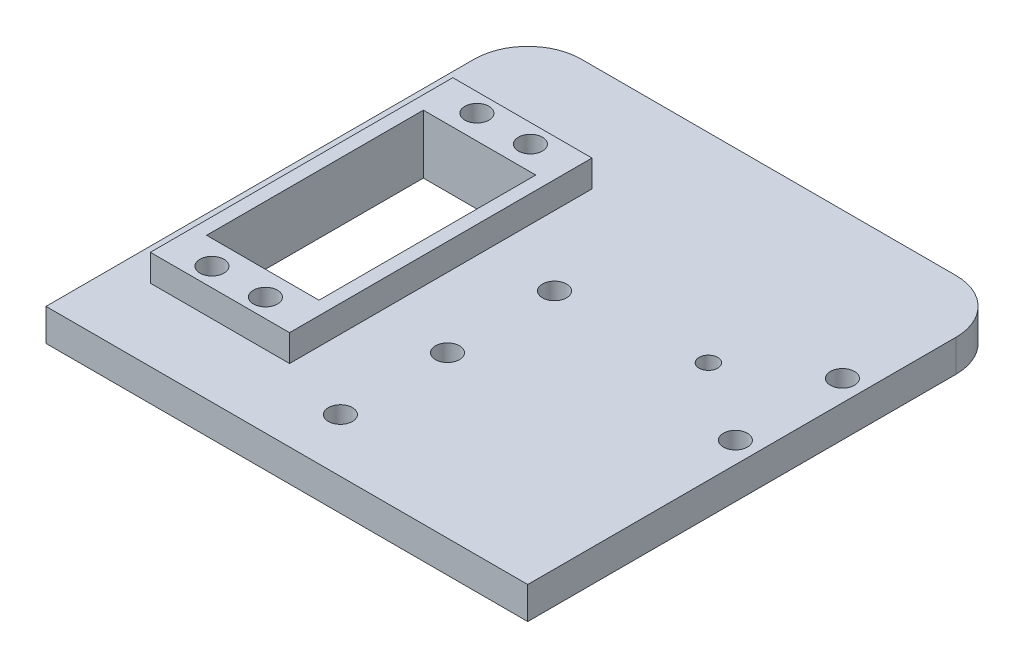
from build123d import *

# Parameters (mm, degrees)
SKETCH1_W           = 90
SKETCH1_H           = 90
BOSS_EXTRUDE1_DEPTH = 6
SKETCH2_W           = 26
SKETCH2_H           = 56.5
BOSS_EXTRUDE2_DEPTH = 5
SKETCH3_W           = 21
SKETCH3_H           = 40.5
CUT_EXTRUDE1_DEPTH  = 12
SKETCH4_R           = 2.25
CUT_EXTRUDE2_DEPTH  = 10
SKETCH5_R           = 1.75
CUT_EXTRUDE3_DEPTH  = 11
FILLET1_R           = 10
FILLET2_R           = 10
SKETCH6_R           = 2.25
CUT_EXTRUDE4_DEPTH  = 11
SKETCH7_R           = 9.5
SKETCH7_R_2         = 7.5
BOSS_EXTRUDE3_DEPTH = 2
SKETCH8_R           = 2.25
CUT_EXTRUDE5_DEPTH  = 10


with BuildPart() as part:
    # Sketch1 → Boss-Extrude1 (new body)
    with BuildSketch(Plane(origin=(0, 0, 0), x_dir=(1, 0, 0), z_dir=(0, 1, 0))):
        with Locations((0, -5)):
            Rectangle(SKETCH1_W, SKETCH1_H)
    extrude(amount=BOSS_EXTRUDE1_DEPTH)

    # Sketch2 → Boss-Extrude2 (add)
    with BuildSketch(Plane(origin=(0, 6, 0), x_dir=(1, 0, 0), z_dir=(0, 1, 0))):
        with Locations((-26, -8.25)):
            Rectangle(SKETCH2_W, SKETCH2_H)
    extrude(amount=BOSS_EXTRUDE2_DEPTH)

    # Sketch3 → Cut-Extrude1 (cut)
    with BuildSketch(Plane(origin=(0, 11, 0), x_dir=(1, 0, 0), z_dir=(0, 1, 0))):
        with Locations((-26, -8.25)):
            Rectangle(SKETCH3_W, SKETCH3_H)
    extrude(amount=-CUT_EXTRUDE1_DEPTH, mode=Mode.SUBTRACT)

    # Sketch4 → Cut-Extrude2 (cut)
    with BuildSketch(Plane(origin=(0, 11, 0), x_dir=(1, 0, 0), z_dir=(0, 1, 0))):
        with Locations(Location((-31, 16.5, 0), (0, 0, 270))):
            Circle(SKETCH4_R)
        with Locations(Location((-21, 16.5, 0), (0, 0, 270))):
            Circle(SKETCH4_R)
        with Locations(Location((-31, -33, 0), (0, 0, 270))):
            Circle(SKETCH4_R)
        with Locations(Location((-21, -33, 0), (0, 0, 270))):
            Circle(SKETCH4_R)
    extrude(amount=-CUT_EXTRUDE2_DEPTH, mode=Mode.SUBTRACT)

    # Sketch5 → Cut-Extrude3 (cut)
    with BuildSketch(Plane(origin=(0, 6, 0), x_dir=(1, 0, 0), z_dir=(0, 1, 0))):
        with Locations(Location((26, 2.75, 0), (0, 0, 270))):
            Circle(SKETCH5_R)
    extrude(amount=-CUT_EXTRUDE3_DEPTH, mode=Mode.SUBTRACT)

    # Fillet1
    fillet1_edges = [part.edges().sort_by_distance(p)[0] for p in [
        (-45, 3, -40),
    ]]
    fillet(fillet1_edges, radius=FILLET1_R)

    # Fillet2
    fillet2_edges = [part.edges().sort_by_distance(p)[0] for p in [
        (45, 3, -40),
    ]]
    fillet(fillet2_edges, radius=FILLET2_R)

    # Sketch6 → Cut-Extrude4 (cut)
    with BuildSketch(Plane(origin=(0, 0, 0), x_dir=(-1, 0, 0), z_dir=(0, -1, 0))):
        with Locations(Location((-41.042034918, 12.75, 0), (0, 0, 90))):
            Circle(SKETCH6_R)
        with Locations(Location((41.697396753, 12.75, 0), (0, 0, 90))):
            Circle(SKETCH6_R)
        with Locations(Location((-41.042034918, -7.25, 0), (0, 0, 90))):
            Circle(SKETCH6_R)
        with Locations(Location((41.697396753, -7.25, 0), (0, 0, 90))):
            Circle(SKETCH6_R)
    extrude(amount=-CUT_EXTRUDE4_DEPTH, mode=Mode.SUBTRACT)

    # Sketch7 → Boss-Extrude3 (add)
    with BuildSketch(Plane(origin=(0, 0, 0), x_dir=(-1, 0, 0), z_dir=(0, -1, 0))):
        with Locations(Location((-26, 2.75, 0), (0, 0, 270))):
            Circle(SKETCH7_R)
        with Locations(Location((-26, 2.75, 0), (0, 0, 90))):
            Circle(SKETCH7_R_2, mode=Mode.SUBTRACT)
    extrude(amount=BOSS_EXTRUDE3_DEPTH)

    # Sketch8 → Cut-Extrude5 (cut)
    with BuildSketch(Plane(origin=(0, 6, 0), x_dir=(1, 0, 0), z_dir=(0, 1, 0))):
        with Locations(Location((0, 0, 0), (0, 0, 270))):
            Circle(SKETCH8_R)
        with Locations(Location((0, -20, 0), (0, 0, 270))):
            Circle(SKETCH8_R)
        with Locations(Location((0, -40, 0), (0, 0, 270))):
            Circle(SKETCH8_R)
    extrude(amount=-CUT_EXTRUDE5_DEPTH, mode=Mode.SUBTRACT)


solid = part.part
